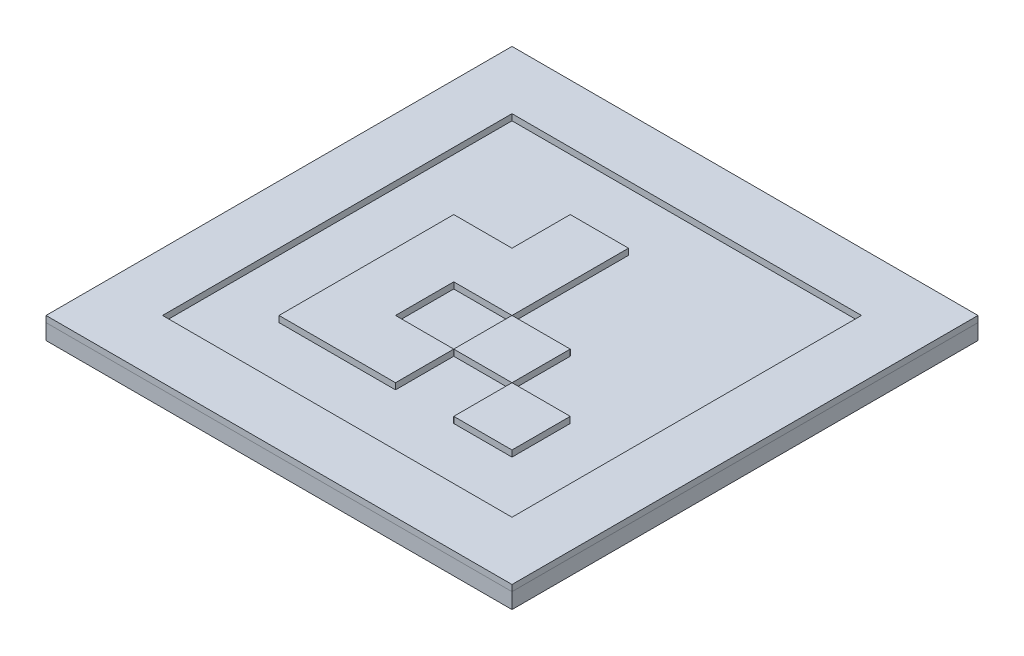
from build123d import *

# Parameters (mm, degrees)
SKETCH_1_W          = 150
SKETCH_1_H          = 150
EXTRUDE_1_DEPTH     = 5
SKETCH_10_W         = 150
SKETCH_10_H         = 150
SKETCH_10_W_2       = 112.5
SKETCH_10_H_2       = 112.5
SKETCH_10_W_3       = 18.75
SKETCH_10_H_3       = 18.75
EXTRUDE_8_DEPTH     = 2
SKETCH_6_W          = 10.6
SKETCH_6_H          = 5.6
CUT_EXTRUDE_1_DEPTH = 4
SKETCH_7_W          = 10.6
SKETCH_7_H          = 5.6
EXTRUDE_7_DEPTH     = 1


with BuildPart() as part:
    # Эскиз1 → Бобышка-Вытянуть1 (new body)
    with BuildSketch(Plane(origin=(0, 0, 0), x_dir=(1, 0, 0), z_dir=(0, 1, 0))):
        Rectangle(SKETCH_1_W, SKETCH_1_H)
    extrude(amount=EXTRUDE_1_DEPTH)

    # Эскиз6 → Вырез-Вытянуть1 (cut)
    with BuildSketch(Plane(origin=(0, 5, 0), x_dir=(1, 0, 0), z_dir=(0, 1, 0))):
        with Locations((67.25, -67.25)):
            Rectangle(SKETCH_6_W, SKETCH_6_H)
        with Locations((-67.25, -67.25)):
            Rectangle(SKETCH_6_W, SKETCH_6_H)
        with Locations((-67.25, 67.25)):
            Rectangle(SKETCH_6_W, SKETCH_6_H)
        with Locations((67.25, 67.25)):
            Rectangle(SKETCH_6_W, SKETCH_6_H)
    extrude(amount=-CUT_EXTRUDE_1_DEPTH, mode=Mode.SUBTRACT)

    # Эскиз7 → Бобышка-Вытянуть7 (add)
    with BuildSketch(Plane(origin=(0, 5, 0), x_dir=(1, 0, 0), z_dir=(0, 1, 0))):
        with Locations((67.25, -67.25)):
            Rectangle(SKETCH_7_W, SKETCH_7_H)
        with Locations((-67.25, -67.25)):
            Rectangle(SKETCH_7_W, SKETCH_7_H)
        with Locations((67.25, 67.25)):
            Rectangle(SKETCH_7_W, SKETCH_7_H)
        with Locations((-67.25, 67.25)):
            Rectangle(SKETCH_7_W, SKETCH_7_H)
    extrude(amount=-EXTRUDE_7_DEPTH)


with BuildPart() as body_2:
    # Эскиз10 → Бобышка-Вытянуть8 (new body)
    # profile 1 of 9: a face of its own
    with BuildSketch(Plane(origin=(0, 5, 0), x_dir=(1, 0, 0), z_dir=(0, 1, 0))):
        Rectangle(SKETCH_10_W, SKETCH_10_H)
        Rectangle(SKETCH_10_W_2, SKETCH_10_H_2, mode=Mode.SUBTRACT)
    # profile 2 of 9: a face of its own
    with BuildSketch(Plane(origin=(0, 5, 0), x_dir=(1, 0, 0), z_dir=(0, 1, 0))):
        with Locations((28.125, -28.125)):
            Rectangle(SKETCH_10_W_3, SKETCH_10_H_3)
    # profile 3 of 9: a face of its own
    with BuildSketch(Plane(origin=(0, 5, 0), x_dir=(1, 0, 0), z_dir=(0, 1, 0))):
        with Locations((9.375, -9.375)):
            Rectangle(SKETCH_10_W_3, SKETCH_10_H_3)
    # profile 4 of 9: a face of its own
    with BuildSketch(Plane(origin=(0, 5, 0), x_dir=(1, 0, 0), z_dir=(0, 1, 0))):
        with Locations((-9.375, -28.125)):
            Rectangle(SKETCH_10_W_3, SKETCH_10_H_3)
    # profile 5 of 9: a face of its own
    with BuildSketch(Plane(origin=(0, 5, 0), x_dir=(1, 0, 0), z_dir=(0, 1, 0))):
        with Locations((-28.125, -28.125)):
            Rectangle(SKETCH_10_W_3, SKETCH_10_H_3)
    # profile 6 of 9: a face of its own
    with BuildSketch(Plane(origin=(0, 5, 0), x_dir=(1, 0, 0), z_dir=(0, 1, 0))):
        with Locations((-28.125, -9.375)):
            Rectangle(SKETCH_10_W_3, SKETCH_10_H_3)
    # profile 7 of 9: a face of its own
    with BuildSketch(Plane(origin=(0, 5, 0), x_dir=(1, 0, 0), z_dir=(0, 1, 0))):
        with Locations((-28.125, 9.375)):
            Rectangle(SKETCH_10_W_3, SKETCH_10_H_3)
    # profile 8 of 9: a face of its own
    with BuildSketch(Plane(origin=(0, 5, 0), x_dir=(1, 0, 0), z_dir=(0, 1, 0))):
        with Locations((-9.375, 9.375)):
            Rectangle(SKETCH_10_W_3, SKETCH_10_H_3)
    # profile 9 of 9: a face of its own
    with BuildSketch(Plane(origin=(0, 5, 0), x_dir=(1, 0, 0), z_dir=(0, 1, 0))):
        with Locations((-9.375, 28.125)):
            Rectangle(SKETCH_10_W_3, SKETCH_10_H_3)
    extrude(amount=EXTRUDE_8_DEPTH)


solid = Compound([part.part, body_2.part])
